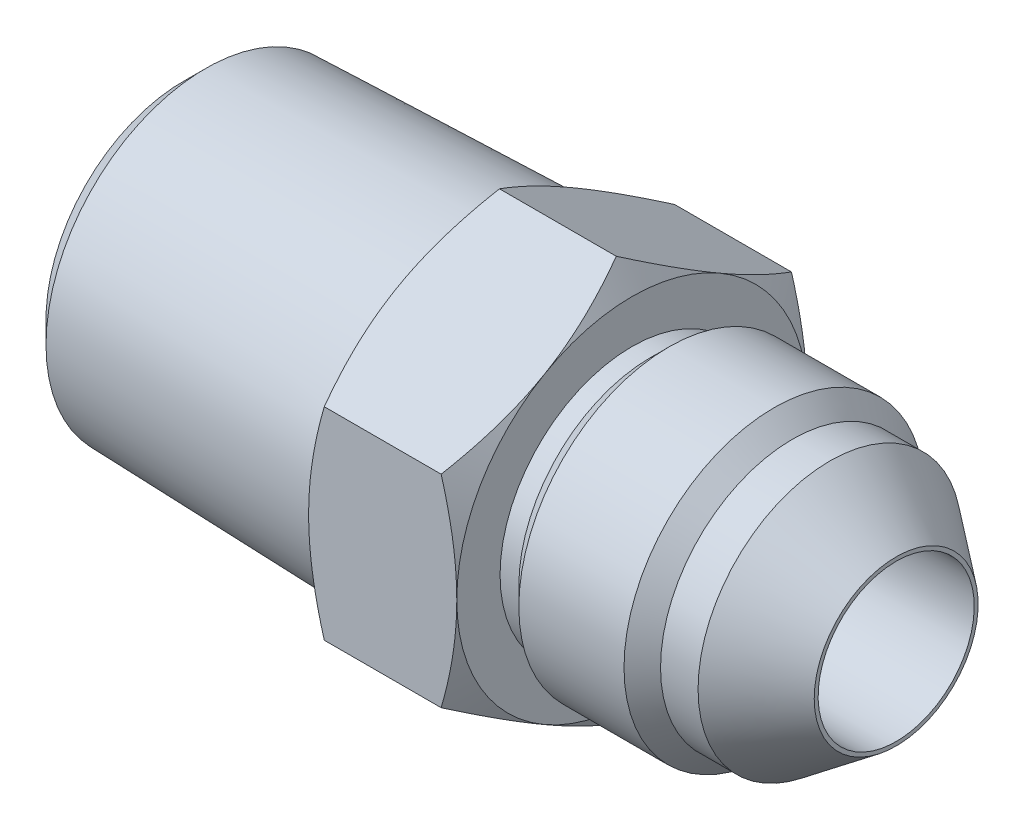
from build123d import *

# Parameters (mm, degrees)
SKETCH6_W           = 45.212
SKETCH6_H           = 9.525
EXTRUDE1_DEPTH      = 9.398
SKETCH7_W           = 45.212
SKETCH7_H           = 4.953
SKETCH17_R          = 9.525
CUT_EXTRUDE1_DEPTH  = 19.05
SKETCH19_R          = 10.668
BOSS_EXTRUDE1_DEPTH = 19.05
BOSS_EXTRUDE1_DRAFT = -1.75
CHAMFER1_SIZE       = 1.360714286
CHAMFER1_SIZE2      = 1.404253042
SKETCH22_R          = 10.668
BOSS_EXTRUDE3_DEPTH = 19.05
BOSS_EXTRUDE3_DRAFT = -15
SKETCH23_R          = 4.953
CUT_EXTRUDE2_DEPTH  = 19.05


with BuildPart() as part:
    # Sketch6 → Revolve3 (revolve)
    with BuildSketch(Plane.XY, mode=Mode.PRIVATE) as revolve3_sk:
        with Locations((0, 4.7625)):
            Rectangle(SKETCH6_W, SKETCH6_H)
    revolve(revolve3_sk.sketch.rotate(Axis((-22.606, 0, 0), (1, 0, 0)), 90), axis=Axis((-22.606, 0, 0), (1, 0, 0)))

    # Sketch12 → Extrude1 (add)
    with BuildSketch(Plane(origin=(-3.556, 0, 0), x_dir=(0, 0, -1), z_dir=(1, 0, 0))):
        Polygon((0, 12.831609733), (-11.1125, 6.415804866), (-11.1125, -6.415804866), (0, -12.831609733), (11.1125, -6.415804866), (11.1125, 6.415804866), align=None)
    extrude(amount=EXTRUDE1_DEPTH)

    # Sketch10 → Cut-Revolve6 (revolve, cut)
    with BuildSketch(Plane.XY, mode=Mode.PRIVATE) as cut_revolve6_sk:
        Polygon((8.190736496, 9.525), (5.842, 9.525), (5.842, 8.366888504), (7.032625, 8.366888504), align=None)
        Polygon((22.606, 9.525), (14.864898093, 9.525), (16.02300959, 8.366888504), (18.40425959, 8.366888504), (22.606, 5.20065), align=None)
    revolve(cut_revolve6_sk.sketch.rotate(Axis((-22.606, 0, 0), (1, 0, 0)), 90), axis=Axis((-22.606, 0, 0), (1, 0, 0)), mode=Mode.SUBTRACT)

    # Sketch7 → Cut-Revolve5 (revolve, cut)
    with BuildSketch(Plane.XY):
        with Locations((0, 2.4765)):
            Rectangle(SKETCH7_W, SKETCH7_H)
    revolve(axis=Axis((22.606, 0, 0), (-1, 0, 0)), mode=Mode.SUBTRACT)

    # Sketch13 → Cut-Revolve7 (revolve, cut)
    with BuildSketch(Plane.XY):
        Polygon((-3.556, 12.831609733), (-3.556, 11.1125), (-2.563471533, 12.831609733), align=None)
        Polygon((4.849471533, 12.831609733), (5.842, 11.1125), (5.842, 12.831609733), align=None)
    revolve(axis=Axis((-22.606, 0, 0), (1, 0, 0)), mode=Mode.SUBTRACT)

    # Sketch17 → Cut-Extrude1 (cut)
    with BuildSketch(Plane.ZY.offset(22.606)):
        Circle(SKETCH17_R)
    extrude(amount=-CUT_EXTRUDE1_DEPTH, mode=Mode.SUBTRACT)


with BuildPart() as body_2:
    # Sketch19 → Boss-Extrude1 (with draft: the straight prism first)
    with BuildSketch(Plane(origin=(-3.556, 0, 0), x_dir=(0, 0, -1), z_dir=(1, 0, 0))):
        Circle(SKETCH19_R)
    extrude(amount=-BOSS_EXTRUDE1_DEPTH)
    # Boss-Extrude1: the draft: its side faces are tilted about the plane it starts from
    boss_extrude1_sides = [body_2.faces().sort_by_distance(p)[0] for p in [
        (-13.081, 0, 10.668),
    ]]
    draft(boss_extrude1_sides, Plane(origin=(-3.556, 0, 0), x_dir=(0, 0, -1), z_dir=(1, 0, 0)), BOSS_EXTRUDE1_DRAFT)

    # Chamfer1
    chamfer1_edges = [body_2.edges().sort_by_distance(p)[0] for p in [
        (-22.606, 0, 10.085969859),
    ]]
    chamfer1_side = [body_2.faces().sort_by_distance(p)[0] for p in [
        (-22.606, 0, 0),
    ]]
    chamfer(chamfer1_edges, length=CHAMFER1_SIZE, length2=CHAMFER1_SIZE2, reference=chamfer1_side[0])


with BuildPart() as boss_extrude3_tool:
    # Sketch22 → Boss-Extrude3 (with draft: the straight prism first)
    with BuildSketch(Plane(origin=(-3.556, 0, 0), x_dir=(0, 0, -1), z_dir=(1, 0, 0))):
        Circle(SKETCH22_R)
    extrude(amount=-BOSS_EXTRUDE3_DEPTH)
    # Boss-Extrude3: the draft: its side faces are tilted about the plane it starts from
    boss_extrude3_sides = [boss_extrude3_tool.faces().sort_by_distance(p)[0] for p in [
        (-13.081, 0, 10.668),
    ]]
    draft(boss_extrude3_sides, Plane(origin=(-3.556, 0, 0), x_dir=(0, 0, -1), z_dir=(1, 0, 0)), BOSS_EXTRUDE3_DRAFT)


with BuildPart() as body_2_1:
    add(body_2.part)

    # Boss-Extrude3: add boss_extrude3_tool
    add(boss_extrude3_tool.part)

    # Combine1: union part
    add(part.part)

    # Sketch23 → Cut-Extrude2 (cut)
    with BuildSketch(Plane.ZY.offset(22.606)):
        with Locations(Location((0, 0, 0), (0, 0, 90))):
            Circle(SKETCH23_R)
    extrude(amount=-CUT_EXTRUDE2_DEPTH, mode=Mode.SUBTRACT)


solid = body_2_1.part
